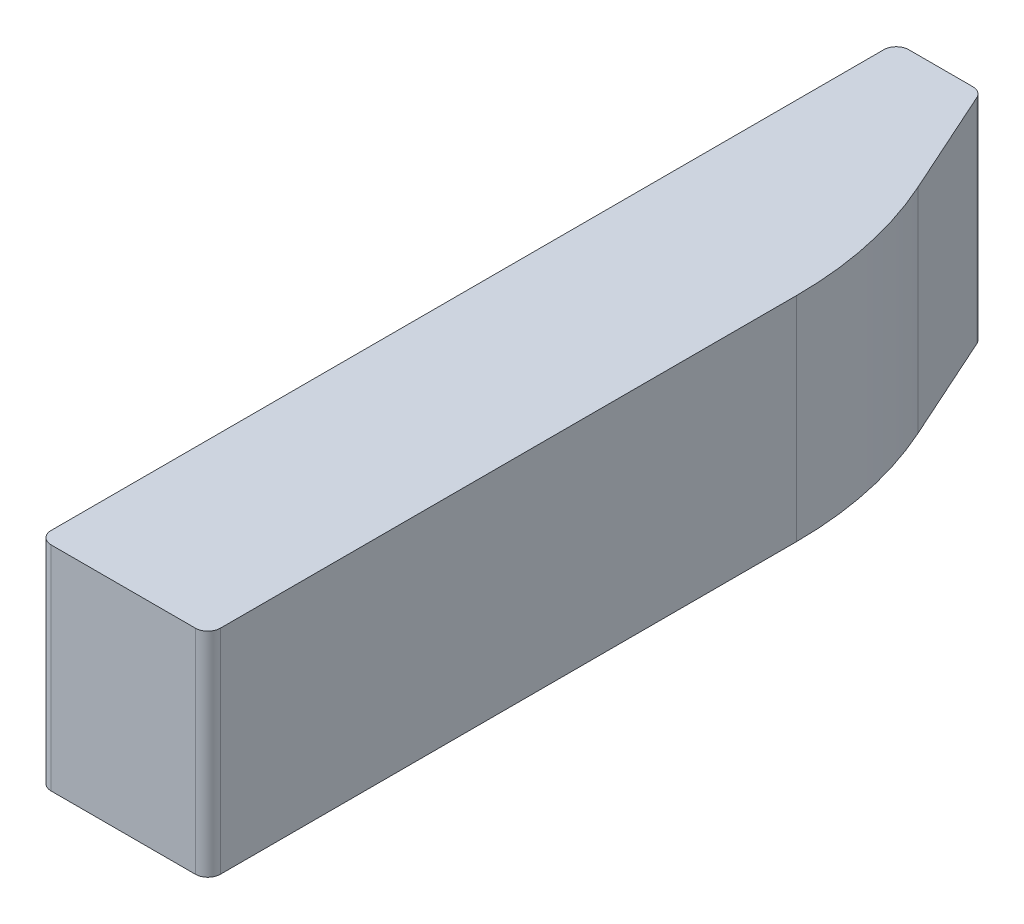
from build123d import *

# Parameters (mm, degrees)
SKETCH_1_W          = 13.5
SKETCH_1_H          = 68.4
EXTRUDE_1_DEPTH     = 17
SKETCH_2_R          = 2.75
CUT_EXTRUDE_1_DEPTH = 5
CUT_EXTRUDE_2_DEPTH = 17
EXTRUDE_2_DEPTH     = 5.5
SKETCH_11_W         = 4
SKETCH_11_H         = 20
CUT_EXTRUDE_7_DEPTH = 17
FILLET_1_R          = 30
FILLET_2_R          = 1
SKETCH_7_W          = 30
SKETCH_7_H          = 69.053295448
CUT_EXTRUDE_4_DEPTH = 17


with BuildPart() as part:
    # ｽｹｯﾁ1 → ﾎﾞｽ - 押し出し1 (new body)
    with BuildSketch(Plane(origin=(0, 0, 0), x_dir=(1, 0, 0), z_dir=(0, 1, 0))):
        with Locations((6.75, 34.2)):
            Rectangle(SKETCH_1_W, SKETCH_1_H)
    extrude(amount=EXTRUDE_1_DEPTH)

    # ｽｹｯﾁ2 → ｶｯﾄ - 押し出し1 (cut)
    with BuildSketch(Plane.XZ):
        with Locations(Location((8.5, -47.4, 0), (0, 0, 270))):
            Circle(SKETCH_2_R)
        with Locations(Location((8.5, -11, 0), (0, 0, 90))):
            Circle(SKETCH_2_R)
    extrude(amount=-CUT_EXTRUDE_1_DEPTH, mode=Mode.SUBTRACT)

    # ｽｹｯﾁ3 → ｶｯﾄ - 押し出し2 (cut)
    with BuildSketch(Plane(origin=(0, 17, 0), x_dir=(1, 0, 0), z_dir=(0, 1, 0))):
        Polygon((6.75, 68.4), (0, 68.4), (0, 53.4), align=None)
    extrude(amount=-CUT_EXTRUDE_2_DEPTH, mode=Mode.SUBTRACT)

    # ｽｹｯﾁ4 → ﾎﾞｽ - 押し出し2 (add)
    with BuildSketch(Plane.XZ):
        Polygon((0, -47), (-4, -37), (-4, -27), (0, -27), align=None)
    extrude(amount=-EXTRUDE_2_DEPTH)

    # ｽｹｯﾁ11 → ｶｯﾄ - 押し出し7 (cut)
    with BuildSketch(Plane(origin=(0, 17, 0), x_dir=(1, 0, 0), z_dir=(0, 1, 0))):
        with Locations((-2, 37)):
            Rectangle(SKETCH_11_W, SKETCH_11_H)
    extrude(amount=-CUT_EXTRUDE_7_DEPTH, mode=Mode.SUBTRACT)

    # ﾌｨﾚｯﾄ1
    fillet_1_edges = [part.edges().sort_by_distance(p)[0] for p in [
        (0, 8.5, -53.4),
    ]]
    fillet(fillet_1_edges, radius=FILLET_1_R)

    # ﾌｨﾚｯﾄ2
    fillet_2_edges = [part.edges().sort_by_distance(p)[0] for p in [
        (6.75, 8.5, -68.4),
        (13.5, 8.5, -68.4),
        (13.5, 8.5, 0),
        (0, 8.5, 0),
    ]]
    fillet(fillet_2_edges, radius=FILLET_2_R)


with BuildPart() as body_2:
    # ﾐﾗｰ1: mirrored copy
    add(part.part.mirror(Plane.ZY.offset(10)))


with BuildPart() as part_1:
    add(part.part)

    # ｽｹｯﾁ7 → ｶｯﾄ - 押し出し4 (cut)
    with BuildSketch(Plane(origin=(0, 17, 0), x_dir=(1, 0, 0), z_dir=(0, 1, 0))):
        with Locations((-1.5, 34.526647724)):
            Rectangle(SKETCH_7_W, SKETCH_7_H)
    extrude(amount=-CUT_EXTRUDE_4_DEPTH, mode=Mode.SUBTRACT)


solid = body_2.part
